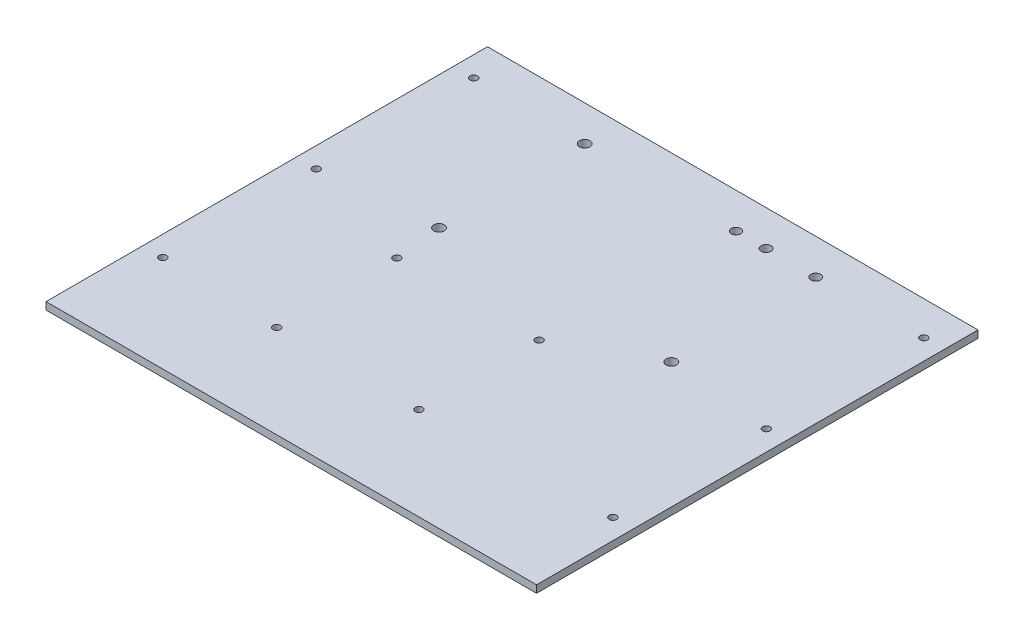
from build123d import *

# Parameters (mm, degrees)
SKETCH_1_W          = 200
SKETCH_1_H          = 180
EXTRUDE_1_DEPTH     = 3
SKETCH_2_R          = 1.5
CUT_EXTRUDE_1_DEPTH = 3
SKETCH_3_R          = 1.5
CUT_EXTRUDE_2_DEPTH = 3
SKETCH_4_R          = 2.137012609
SKETCH_4_R_2        = 2.00688496
SKETCH_4_R_3        = 1.920113274
CUT_EXTRUDE_3_DEPTH = 3


with BuildPart() as part:
    # 草图1 → 凸台-拉伸1 (new body)
    with BuildSketch(Plane(origin=(0, 0, 0), x_dir=(1, 0, 0), z_dir=(0, 1, 0))):
        Rectangle(SKETCH_1_W, SKETCH_1_H)
    extrude(amount=EXTRUDE_1_DEPTH)

    # 草图2 → 切除-拉伸1 (cut)
    with BuildSketch(Plane(origin=(0, 3, 0), x_dir=(1, 0, 0), z_dir=(0, 1, 0))):
        with Locations(Location((91.756220162, 76.163438047, 0), (0, 0, 270))):
            Circle(SKETCH_2_R)
        with Locations(Location((91.756220162, 11.939610887, 0), (0, 0, 270))):
            Circle(SKETCH_2_R)
        with Locations(Location((91.756220162, -50.625190386, 0), (0, 0, 270))):
            Circle(SKETCH_2_R)
        with Locations(Location((-91.756220162, 76.163438047, 0), (0, 0, 90))):
            Circle(SKETCH_2_R)
        with Locations(Location((-91.756220162, 11.939610887, 0), (0, 0, 90))):
            Circle(SKETCH_2_R)
        with Locations(Location((-91.756220162, -50.625190386, 0), (0, 0, 90))):
            Circle(SKETCH_2_R)
    extrude(amount=-CUT_EXTRUDE_1_DEPTH, mode=Mode.SUBTRACT)

    # 草图3 → 切除-拉伸2 (cut)
    with BuildSketch(Plane(origin=(0, 3, 0), x_dir=(1, 0, 0), z_dir=(0, 1, 0))):
        with Locations(Location((14.144450177, -3.083468073, 0), (0, 0, 270))):
            Circle(SKETCH_3_R)
        with Locations(Location((14.144450177, -52.083468073, 0), (0, 0, 270))):
            Circle(SKETCH_3_R)
        with Locations(Location((-43.855549823, -52.083468073, 0), (0, 0, 270))):
            Circle(SKETCH_3_R)
        with Locations(Location((-43.855549823, -3.083468073, 0), (0, 0, 270))):
            Circle(SKETCH_3_R)
    extrude(amount=-CUT_EXTRUDE_2_DEPTH, mode=Mode.SUBTRACT)

    # 草图4 → 切除-拉伸3 (cut)
    with BuildSketch(Plane(origin=(0, 3, 0), x_dir=(1, 0, 0), z_dir=(0, 1, 0))):
        with Locations(Location((48.794365555, 16.180217446, 0), (0, 0, 270))):
            Circle(SKETCH_4_R)
        with Locations(Location((48.28042953, 75.551923117, 0), (0, 0, 270))):
            Circle(SKETCH_4_R_2)
        with Locations(Location((28.035307004, 75.551923117, 0), (0, 0, 270))):
            Circle(SKETCH_4_R_2)
        with Locations(Location((15.78042953, 75.551923117, 0), (0, 0, 270))):
            Circle(SKETCH_4_R_3)
        with Locations(Location((-45.929479507, 75.551923117, 0), (0, 0, 270))):
            Circle(SKETCH_4_R)
        with Locations(Location((-45.929479507, 16.180217446, 0), (0, 0, 270))):
            Circle(SKETCH_4_R)
    extrude(amount=-CUT_EXTRUDE_3_DEPTH, mode=Mode.SUBTRACT)


solid = part.part
